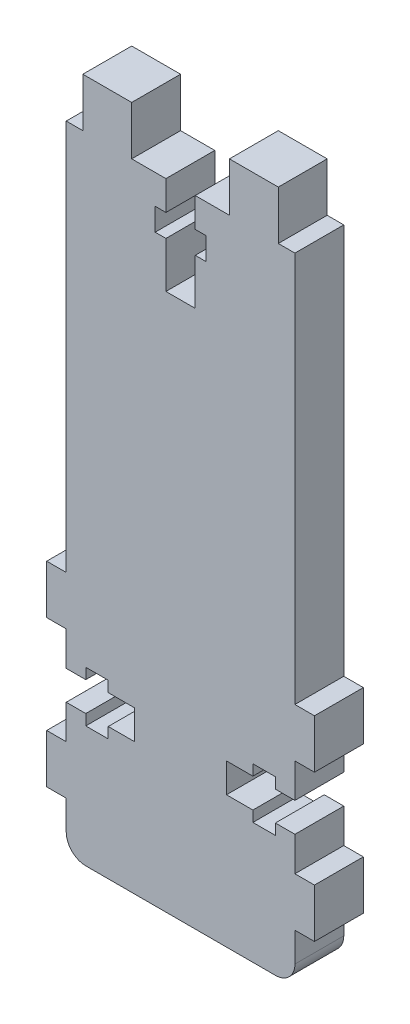
from build123d import *

# Parameters (mm, degrees)
BOSS_EXTRU_1_DEPTH = 5
FILLET1_R          = 2


with BuildPart() as part:
    # Esquisse1 → Boss.-Extru.1 (new body)
    with BuildSketch(Plane.XY):
        Polygon((1.7, 70), (1.7, 65), (0, 65), (0, 25), (-2, 25), (-2, 20), (0, 20), (0, 16.5), (2, 16.5), (2, 17.6), (4.3, 17.6), (4.3, 16.5), (7, 16.5), (7, 13.5), (4.3, 13.5), (4.3, 12.4), (2, 12.4), (2, 13.5), (0, 13.5), (0, 10), (-2, 10), (-2, 5), (0, 5), (0, 0), (23.4, 0), (23.4, 5), (25.4, 5), (25.4, 10), (23.4, 10), (23.4, 13.5), (21.4, 13.5), (21.4, 12.4), (19.1, 12.4), (19.1, 13.5), (16.4, 13.5), (16.4, 16.5), (19.1, 16.5), (19.1, 17.6), (21.4, 17.6), (21.4, 16.5), (23.4, 16.5), (23.4, 20), (25.4, 20), (25.4, 25), (23.4, 25), (23.4, 65), (21.7, 65), (21.7, 70), (16.7, 70), (16.7, 65), (13.2, 65), (13.2, 62), (14.3, 62), (14.3, 59.7), (13.2, 59.7), (13.2, 55), (10.2, 55), (10.2, 59.7), (9.1, 59.7), (9.1, 62), (10.2, 62), (10.2, 65), (6.7, 65), (6.7, 70), align=None)
    extrude(amount=BOSS_EXTRU_1_DEPTH)

    # Fillet1
    fillet1_edges = [part.edges().sort_by_distance(p)[0] for p in [
        (23.4, 0, 2.5),
        (0, 0, 2.5),
    ]]
    fillet(fillet1_edges, radius=FILLET1_R)


solid = part.part
